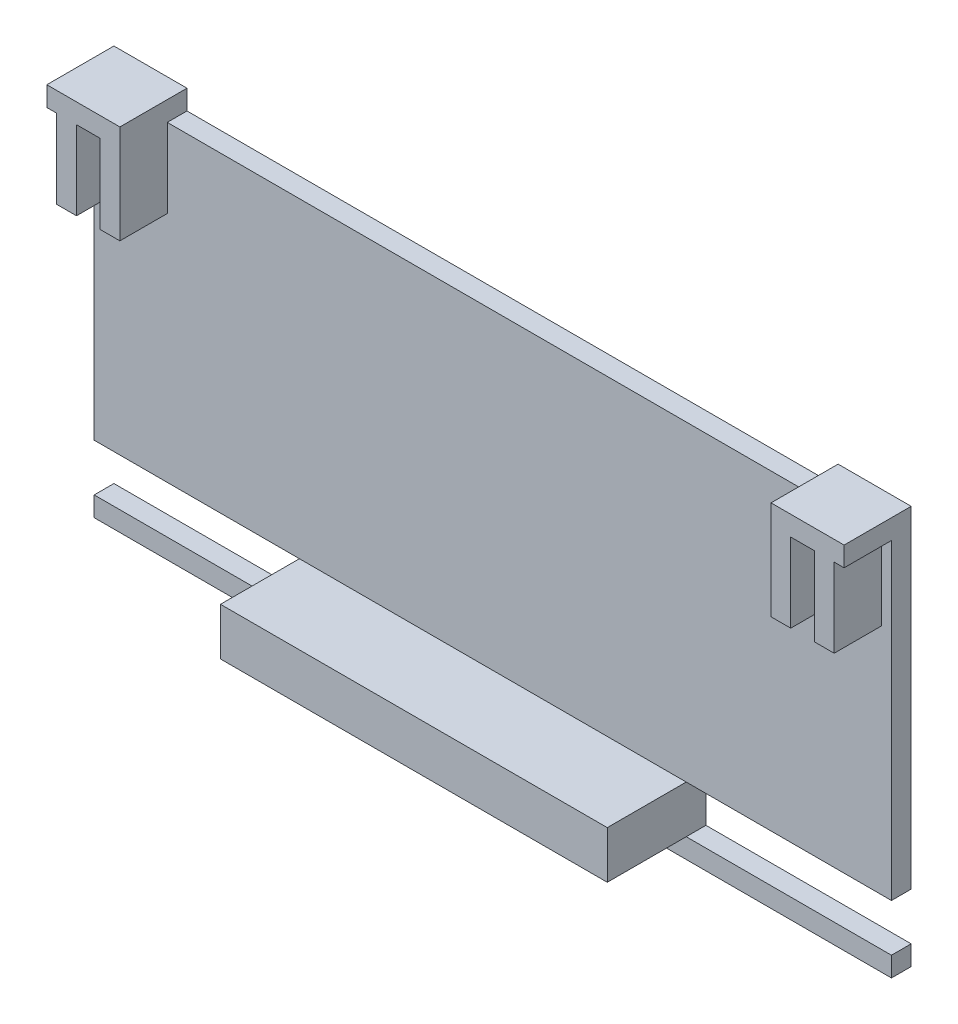
from build123d import *

# Parameters (mm, degrees)
SKETCH1_W           = 50.5
SKETCH1_H           = 24
BOSS_EXTRUDE1_DEPTH = 1.25
SKETCH2_W           = 1.25
SKETCH2_H           = 3
BOSS_EXTRUDE2_DEPTH = 5
SKETCH3_W           = 13
SKETCH3_H           = 3
CUT_EXTRUDE1_DEPTH  = 1.25
SKETCH5_W           = 4.628536498
SKETCH5_H           = 4.25
BOSS_EXTRUDE3_DEPTH = 1.25
SKETCH9_W           = 24.5
SKETCH9_H           = 3
BOSS_EXTRUDE5_DEPTH = 5


with BuildPart() as part:
    # Sketch1 → Boss-Extrude1 (new body)
    with BuildSketch(Plane.XY):
        with Locations((24, 12)):
            Rectangle(SKETCH1_W, SKETCH1_H)
    extrude(amount=BOSS_EXTRUDE1_DEPTH)

    # Sketch2 → Boss-Extrude2 (add)
    with BuildSketch(Plane(origin=(0, 24, 0), x_dir=(1, 0, 0), z_dir=(0, 1, 0))):
        with Locations((47.996463502, -2.75)):
            Rectangle(SKETCH2_W, SKETCH2_H)
        with Locations((45.246463502, -2.75)):
            Rectangle(SKETCH2_W, SKETCH2_H)
        with Locations((2.753536498, -2.75)):
            Rectangle(SKETCH2_W, SKETCH2_H)
        with Locations((0.003536498, -2.75)):
            Rectangle(SKETCH2_W, SKETCH2_H)
    extrude(amount=-BOSS_EXTRUDE2_DEPTH)

    # Sketch3 → Cut-Extrude1 (cut)
    with BuildSketch(Plane(origin=(0, 0, 0), x_dir=(-1, 0, 0), z_dir=(0, 0, -1))):
        with Locations((-42.75, 2.75)):
            Rectangle(SKETCH3_W, SKETCH3_H)
        with Locations((-5.25, 2.75)):
            Rectangle(SKETCH3_W, SKETCH3_H)
    extrude(amount=-CUT_EXTRUDE1_DEPTH, mode=Mode.SUBTRACT)

    # Sketch5 → Boss-Extrude3 (add)
    with BuildSketch(Plane(origin=(0, 24, 0), x_dir=(1, 0, 0), z_dir=(0, 1, 0))):
        with Locations((1.064268249, -2.125)):
            Rectangle(SKETCH5_W, SKETCH5_H)
        with Locations((46.935731751, -2.125)):
            Rectangle(SKETCH5_W, SKETCH5_H)
    extrude(amount=BOSS_EXTRUDE3_DEPTH)

    # Sketch9 → Boss-Extrude5 (add)
    with BuildSketch(Plane.XY.offset(1.25)):
        with Locations((24, 2.75)):
            Rectangle(SKETCH9_W, SKETCH9_H)
    extrude(amount=BOSS_EXTRUDE5_DEPTH)


solid = part.part
